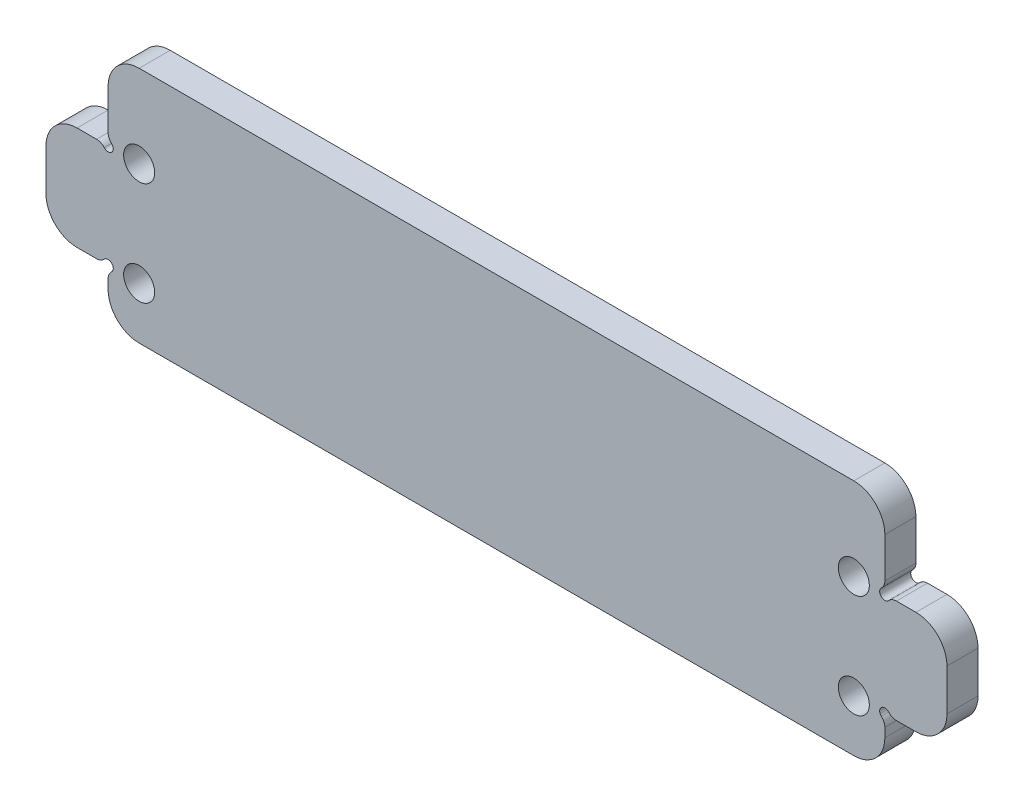
from build123d import *

# Parameters (mm, degrees)
SKETCH_1_R      = 1.5
EXTRUDE_1_DEPTH = 3
FILLET_1_R      = 3
FILLET_2_R      = 1


with BuildPart() as part:
    # 草图1 → 凸台-拉伸1 (new body)
    with BuildSketch(Plane.XY):
        with BuildLine():
            Line((-37.525, 11.5), (37.525, 11.5))
            Line((37.525, 11.5), (37.525, 4))
            ThreePointArc((37.525, 4), (37.171446609, 3.146446609), (38.025, 3.5))
            Line((38.025, 3.5), (43.525, 3.5))
            Line((43.525, 3.5), (43.525, -6.5))
            Line((43.525, -6.5), (38.025, -6.5))
            ThreePointArc((38.025, -6.5), (37.171446609, -6.146446609), (37.525, -7))
            Line((37.525, -7), (37.525, -11.5))
            Line((37.525, -11.5), (-37.525, -11.5))
            Line((-37.525, -11.5), (-37.525, -7))
            ThreePointArc((-37.525, -7), (-37.171446609, -6.146446609), (-38.025, -6.5))
            Line((-38.025, -6.5), (-43.525, -6.5))
            Line((-43.525, -6.5), (-43.525, 3.5))
            Line((-43.525, 3.5), (-38.025, 3.5))
            ThreePointArc((-38.025, 3.5), (-37.171446609, 3.146446609), (-37.525, 4))
            Line((-37.525, 4), (-37.525, 11.5))
        make_face()
        with Locations((34.525, 3.5)):
            Circle(SKETCH_1_R, mode=Mode.SUBTRACT)
        with Locations((34.525, -6.5)):
            Circle(SKETCH_1_R, mode=Mode.SUBTRACT)
        with Locations(Location((-34.525, -6.5, 0), (0, 0, 180))):
            Circle(SKETCH_1_R, mode=Mode.SUBTRACT)
        with Locations(Location((-34.525, 3.5, 0), (0, 0, 180))):
            Circle(SKETCH_1_R, mode=Mode.SUBTRACT)
    extrude(amount=EXTRUDE_1_DEPTH)

    # 圆角1
    fillet_1_edges = [part.edges().sort_by_distance(p)[0] for p in [
        (37.525, -11.5, 1.5),
        (-37.525, -11.5, 1.5),
        (-43.525, -6.5, 1.5),
        (-43.525, 3.5, 1.5),
        (-37.525, 11.5, 1.5),
        (37.525, 11.5, 1.5),
        (43.525, 3.5, 1.5),
        (43.525, -6.5, 1.5),
    ]]
    fillet(fillet_1_edges, radius=FILLET_1_R)

    # 圆角2
    fillet_2_edges = [part.edges().sort_by_distance(p)[0] for p in [
        (-37.525, -7, 1.5),
        (-38.025, -6.5, 1.5),
        (-38.025, 3.5, 1.5),
        (-37.525, 4, 1.5),
        (37.525, 4, 1.5),
        (38.025, 3.5, 1.5),
        (38.025, -6.5, 1.5),
        (37.525, -7, 1.5),
    ]]
    fillet(fillet_2_edges, radius=FILLET_2_R)


solid = part.part
